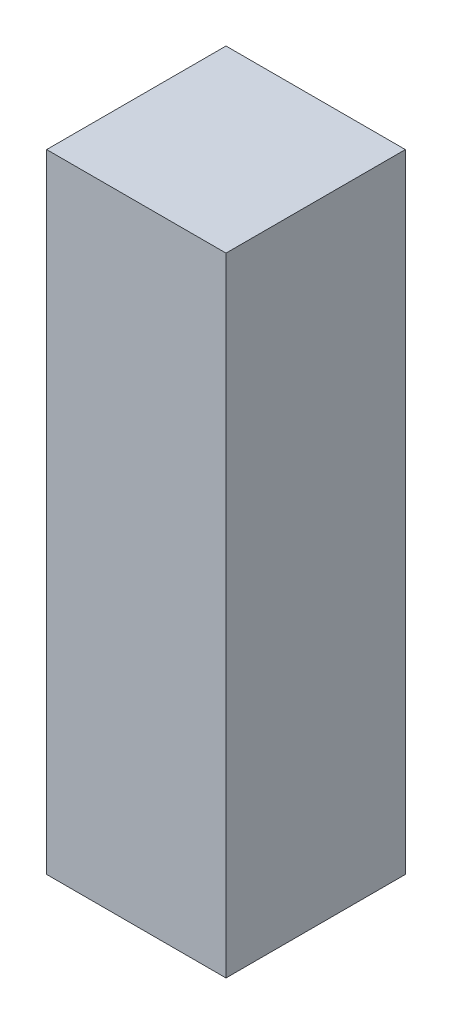
from build123d import *

# Parameters (mm, degrees)
SKETCH1_W           = 25.4
SKETCH1_H           = 25.4
BOSS_EXTRUDE1_DEPTH = 44.45


with BuildPart() as part:
    # Sketch1 → Boss-Extrude1 (new, symmetric)
    with BuildSketch(Plane(origin=(0, 0, 0), x_dir=(1, 0, 0), z_dir=(0, 1, 0))):
        Rectangle(SKETCH1_W, SKETCH1_H)
    extrude(amount=BOSS_EXTRUDE1_DEPTH, both=True)


solid = part.part
